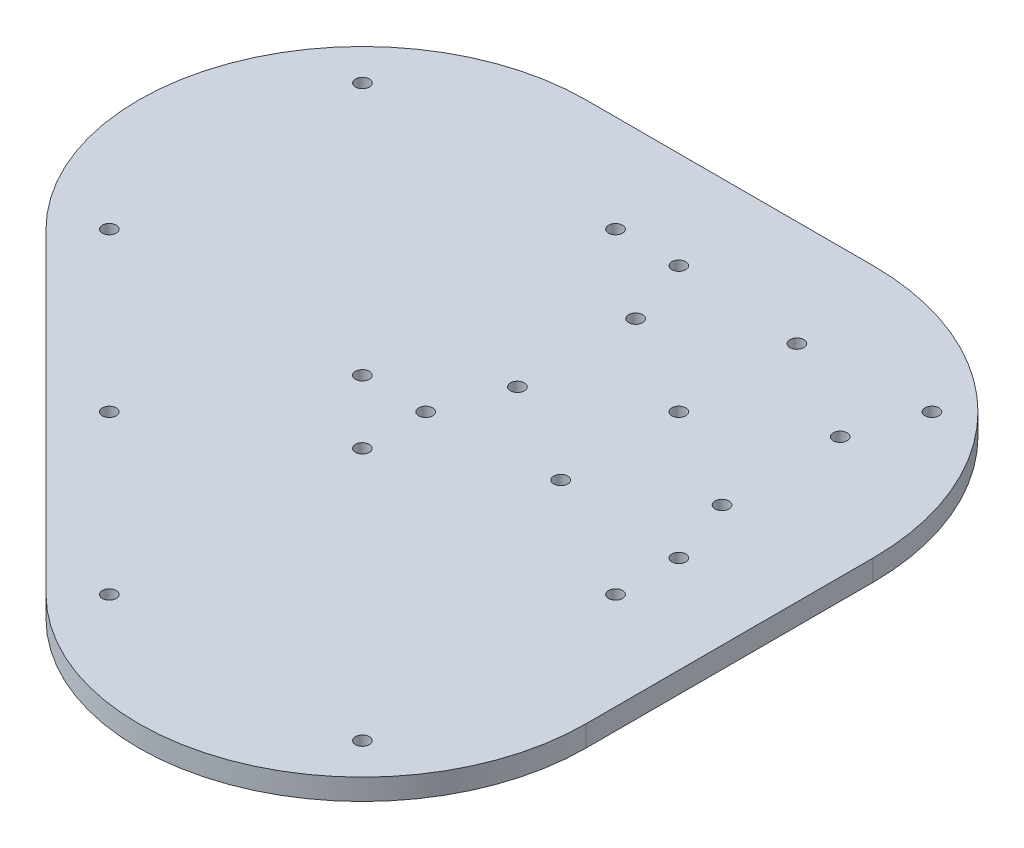
from build123d import *

# Parameters (mm, degrees)
SKETCH_1_R      = 1.65
EXTRUDE_1_DEPTH = 5


with BuildPart() as part:
    # 草图1 → 凸台-拉伸1 (new body)
    with BuildSketch(Plane(origin=(0, 0, 0), x_dir=(1, 0, 0), z_dir=(0, 1, 0))):
        with BuildLine():
            Line((-75, 0), (0, -75))
            ThreePointArc((0, -75), (37.5, -90.533008589), (75, -75))
            ThreePointArc((75, -75), (86.496111183, -57.794853755), (90.533008589, -37.5))
            Line((90.533008589, -37.5), (90.533008589, 30.533008589))
            ThreePointArc((90.533008589, 30.533008589), (72.95941546, 72.95941546), (30.533008589, 90.533008589))
            Line((30.533008589, 90.533008589), (-37.5, 90.533008589))
            ThreePointArc((-37.5, 90.533008589), (-57.794853755, 86.496111183), (-75, 75))
            ThreePointArc((-75, 75), (-90.533008589, 37.5), (-75, 0))
        make_face()
        with Locations(Location((37.5, 65.5, 0), (0, 0, 270))):
            Circle(SKETCH_1_R, mode=Mode.SUBTRACT)
        with Locations(Location((61.748711306, 51.5, 0), (0, 0, 270))):
            Circle(SKETCH_1_R, mode=Mode.SUBTRACT)
        with Locations(Location((61.748711306, 23.5, 0), (0, 0, 270))):
            Circle(SKETCH_1_R, mode=Mode.SUBTRACT)
        with Locations(Location((37.5, 9.5, 0), (0, 0, 270))):
            Circle(SKETCH_1_R, mode=Mode.SUBTRACT)
        with Locations(Location((13.251288694, 23.5, 0), (0, 0, 270))):
            Circle(SKETCH_1_R, mode=Mode.SUBTRACT)
        with Locations(Location((13.251288694, 51.5, 0), (0, 0, 270))):
            Circle(SKETCH_1_R, mode=Mode.SUBTRACT)
        with Locations(Location((7.5, 67.5, 0), (0, 0, 270))):
            Circle(SKETCH_1_R, mode=Mode.SUBTRACT)
        with Locations(Location((67.5, 67.5, 0), (0, 0, 90))):
            Circle(SKETCH_1_R, mode=Mode.SUBTRACT)
        with Locations(Location((67.5, 7.5, 0), (0, 0, 270))):
            Circle(SKETCH_1_R, mode=Mode.SUBTRACT)
        with Locations(Location((7.5, 7.5, 0), (0, 0, 90))):
            Circle(SKETCH_1_R, mode=Mode.SUBTRACT)
        with Locations(Location((37.5, 37.5, 0), (0, 0, 270))):
            Circle(SKETCH_1_R, mode=Mode.SUBTRACT)
        with Locations(Location((-67.5, 67.5, 0), (0, 0, 270))):
            Circle(SKETCH_1_R, mode=Mode.SUBTRACT)
        with Locations(Location((-7.5, 67.5, 0), (0, 0, 270))):
            Circle(SKETCH_1_R, mode=Mode.SUBTRACT)
        with Locations(Location((-67.5, 7.5, 0), (0, 0, 270))):
            Circle(SKETCH_1_R, mode=Mode.SUBTRACT)
        with Locations(Location((-7.5, 7.5, 0), (0, 0, 270))):
            Circle(SKETCH_1_R, mode=Mode.SUBTRACT)
        with Locations(Location((7.5, -67.5, 0), (0, 0, 90))):
            Circle(SKETCH_1_R, mode=Mode.SUBTRACT)
        with Locations(Location((7.5, -7.5, 0), (0, 0, 90))):
            Circle(SKETCH_1_R, mode=Mode.SUBTRACT)
        with Locations(Location((67.5, -7.5, 0), (0, 0, 90))):
            Circle(SKETCH_1_R, mode=Mode.SUBTRACT)
        with Locations(Location((67.5, -67.5, 0), (0, 0, 90))):
            Circle(SKETCH_1_R, mode=Mode.SUBTRACT)
        with Locations(Location((-30, -30, 0), (0, 0, 270))):
            Circle(SKETCH_1_R, mode=Mode.SUBTRACT)
    extrude(amount=EXTRUDE_1_DEPTH)


solid = part.part
